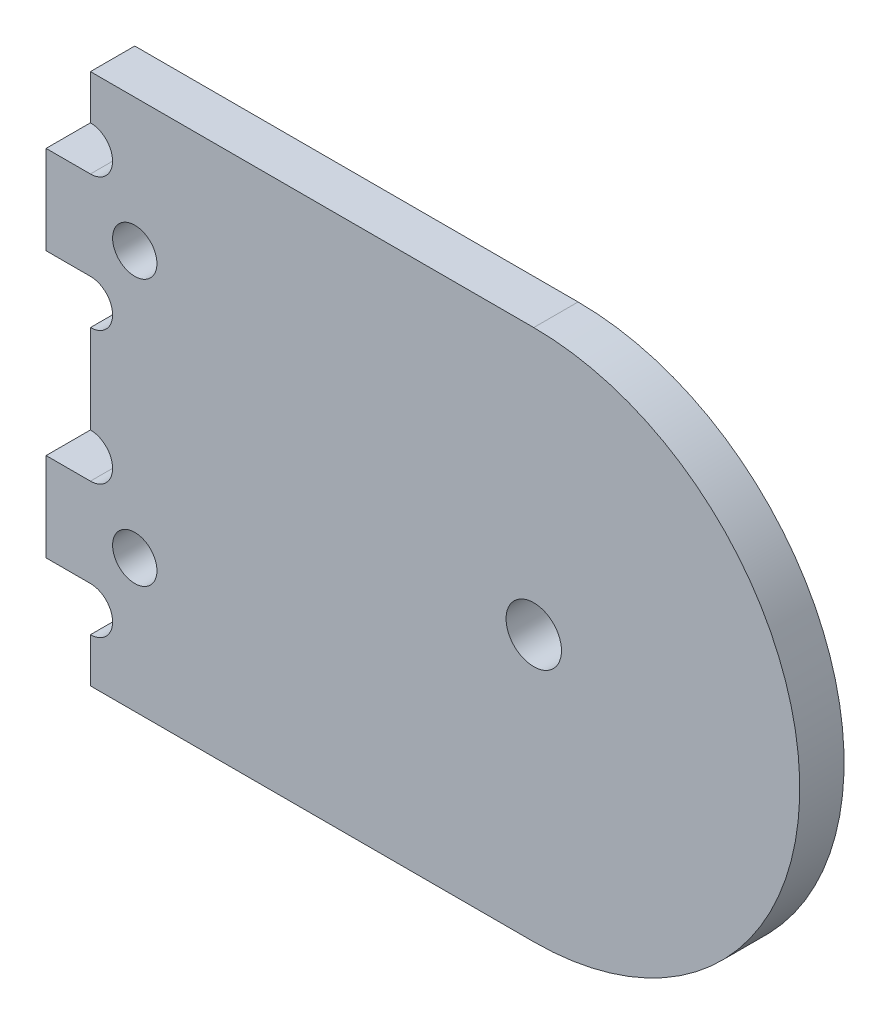
from build123d import *

# Parameters (mm, degrees)
SKETCH_1_R      = 1.25
SKETCH_1_R_2    = 1
EXTRUDE_1_DEPTH = 2


with BuildPart() as part:
    # 草圖1 → 填料-伸長1 (new body)
    with BuildSketch(Plane.XY):
        with BuildLine():
            Line((-36.093061493, 13.879025542), (-16.093061493, 13.879025542))
            ThreePointArc((-16.093061493, 13.879025542), (-4.093061493, 1.879025542), (-16.093061493, -10.120974458))
            Line((-16.093061493, -10.120974458), (-36.093061493, -10.120974458))
            Line((-36.093061493, -10.120974458), (-36.093061493, -8.120974458))
            ThreePointArc((-36.093061493, -8.120974458), (-35.093061493, -7.120974458), (-36.093061493, -6.120974458))
            Line((-36.093061493, -6.120974458), (-38.093061493, -6.120974458))
            Line((-38.093061493, -6.120974458), (-38.093061493, -2.120974458))
            Line((-38.093061493, -2.120974458), (-36.093061493, -2.120974458))
            ThreePointArc((-36.093061493, -2.120974458), (-35.093061493, -1.120974458), (-36.093061493, -0.120974458))
            Line((-36.093061493, -0.120974458), (-36.093061493, 3.879025542))
            ThreePointArc((-36.093061493, 3.879025542), (-35.093061493, 4.879025542), (-36.093061493, 5.879025542))
            Line((-36.093061493, 5.879025542), (-38.093061493, 5.879025542))
            Line((-38.093061493, 5.879025542), (-38.093061493, 9.879025542))
            Line((-38.093061493, 9.879025542), (-36.093061493, 9.879025542))
            ThreePointArc((-36.093061493, 9.879025542), (-35.093061493, 10.879025542), (-36.093061493, 11.879025542))
            Line((-36.093061493, 11.879025542), (-36.093061493, 13.879025542))
        make_face()
        with Locations((-16.093061493, 1.879025542)):
            Circle(SKETCH_1_R, mode=Mode.SUBTRACT)
        with Locations((-34.093061493, 7.879025542)):
            Circle(SKETCH_1_R_2, mode=Mode.SUBTRACT)
        with Locations((-34.093061493, -4.120974458)):
            Circle(SKETCH_1_R_2, mode=Mode.SUBTRACT)
    extrude(amount=EXTRUDE_1_DEPTH)


solid = part.part
